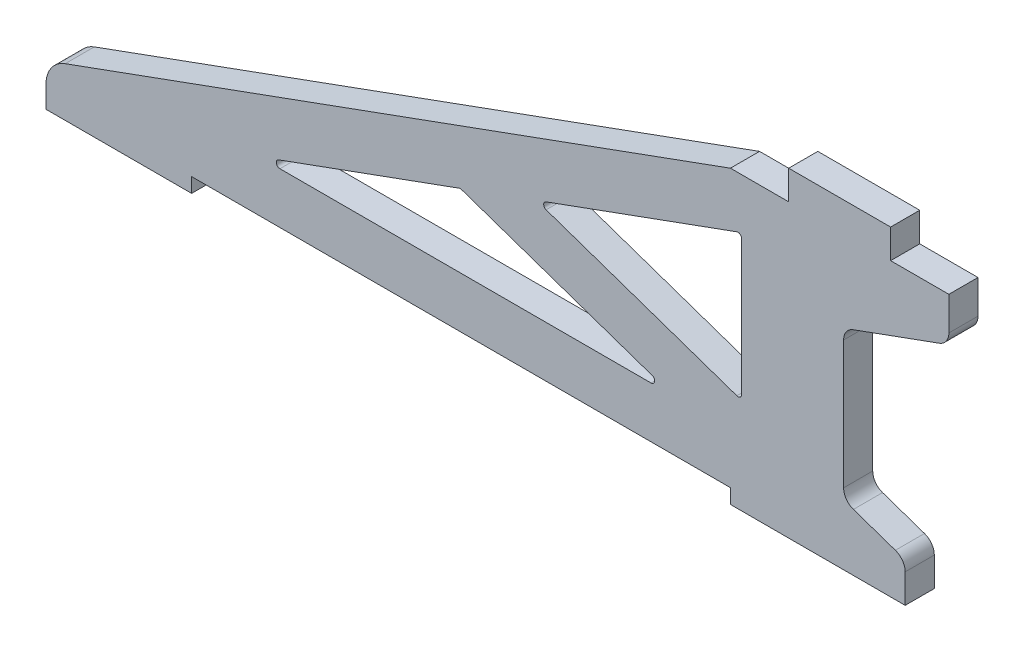
from build123d import *

# Parameters (mm, degrees)
BOSS_EXTRUDE1_DEPTH = 2


with BuildPart() as part:
    # Sketch1 → Boss-Extrude1 (new body)
    with BuildSketch(Plane.XY):
        with BuildLine():
            Line((1.315959713, 3.372369155), (47, 20))
            Line((47, 20), (51, 20))
            Line((51, 20), (51, 22))
            Line((51, 22), (58, 22))
            Line((58, 22), (58, 20))
            Line((58, 20), (62, 20))
            Line((62, 20), (62, 17.700207538))
            ThreePointArc((62, 17.700207538), (61.819152044, 17.126631102), (61.342020143, 16.760514917))
            Line((61.342020143, 16.760514917), (55.428944301, 14.608331318))
            ThreePointArc((55.428944301, 14.608331318), (54.9518124, 14.242215134), (54.770964445, 13.668638697))
            Line((54.770964445, 13.668638697), (54.770964445, 4.876414251))
            ThreePointArc((54.770964445, 4.876414251), (54.956848926, 4.295711295), (55.44539629, 3.930895675))
            Line((55.44539629, 3.930895675), (58.325568154, 2.939172971))
            ThreePointArc((58.325568154, 2.939172971), (58.814115518, 2.574357351), (59, 1.993654396))
            Line((59, 1.993654396), (59, 0))
            Line((59, 0), (47, 0))
            Line((47, 0), (47, 1))
            Line((47, 1), (10, 1))
            Line((10, 1), (10, 0))
            Line((10, 0), (0, 0))
            Line((0, 0), (0, 1.492983913))
            ThreePointArc((0, 1.492983913), (0.361695911, 2.640136786), (1.315959713, 3.372369155))
        make_face()
        with BuildLine():
            Line((15.979730818, 4.984923155), (28.367873469, 9.493838338))
            ThreePointArc((28.367873469, 9.493838338), (28.451196871, 9.508905664), (28.534770543, 9.495294827))
            Line((28.534770543, 9.495294827), (41.629611064, 4.986379644))
            ThreePointArc((41.629611064, 4.986379644), (41.794790425, 4.708738099), (41.548219025, 4.5))
            Line((41.548219025, 4.5), (16.065235854, 4.5))
            ThreePointArc((16.065235854, 4.5), (15.819033916, 4.706587956), (15.979730818, 4.984923155))
        make_face(mode=Mode.SUBTRACT)
        with BuildLine():
            Line((47.770964445, 16.198948904), (47.770964445, 6.92390155))
            ThreePointArc((47.770964445, 6.92390155), (47.666140184, 6.72037267), (47.439572406, 6.687521906))
            Line((47.439572406, 6.687521906), (34.344731886, 11.196437088))
            ThreePointArc((34.344731886, 11.196437088), (34.176133444, 11.430635098), (34.340618889, 11.667739888))
            Line((34.340618889, 11.667739888), (47.435459409, 16.433872059))
            ThreePointArc((47.435459409, 16.433872059), (47.664358554, 16.403736915), (47.770964445, 16.198948904))
        make_face(mode=Mode.SUBTRACT)
    extrude(amount=BOSS_EXTRUDE1_DEPTH)


solid = part.part
